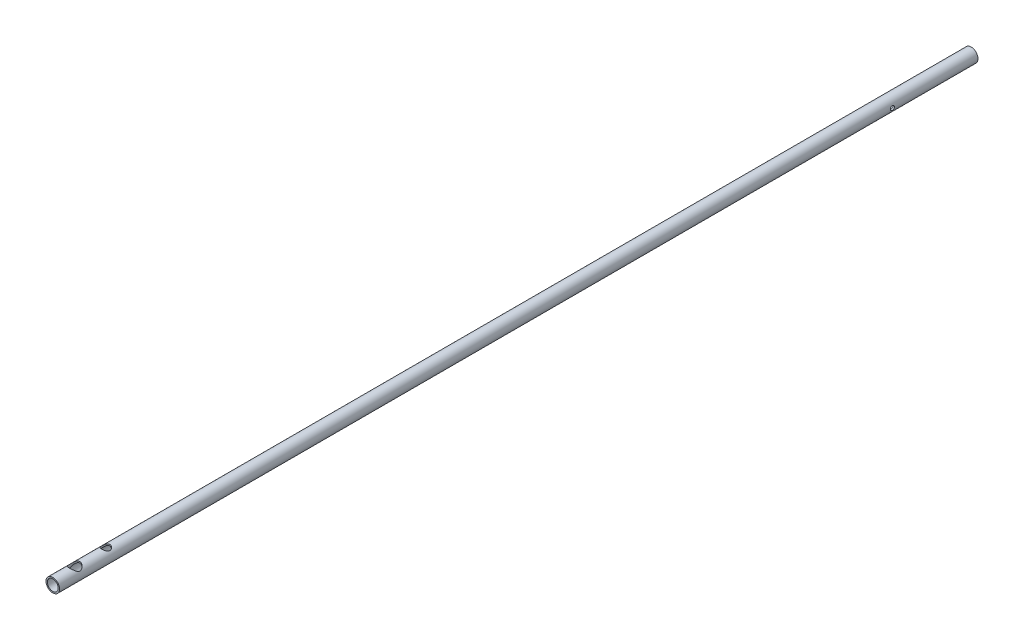
from build123d import *

# Parameters (mm, degrees)
SKETCH_1_R               = 5
SKETCH_1_R_2             = 4
EXTRUDE_1_DEPTH          = 676.5
CUT_EXTRUDE_1_DEPTH      = 677.536953906
CUT_EXTRUDE_1_DEPTH_BACK = 677.536953906
SKETCH_2_R               = 2
SKETCH_2_R_2             = 1.5
SKETCH_2_3_R             = 4
SKETCH_2_3_R_2           = 3
CUT_EXTRUDE_2_DEPTH      = 677.536954007
CUT_EXTRUDE_3_DEPTH      = 677.536954007
CUT_EXTRUDE_3_DEPTH_BACK = 677.536954007
SKETCH_3_R               = 1.5
SKETCH_3_3_R             = 3
CUT_EXTRUDE_4_DEPTH      = 10


with BuildPart() as part:
    # ｽｹｯﾁ1 → 押し出し-薄板1 (new body)
    with BuildSketch(Plane.XY):
        Circle(SKETCH_1_R)
        Circle(SKETCH_1_R_2, mode=Mode.SUBTRACT)
    extrude(amount=EXTRUDE_1_DEPTH)

    # ｽｹｯﾁ2 → ｶｯﾄ - 押し出し1 (cut, two sides: drawn at the far end of the back side and taken through both)
    with BuildSketch(Plane(origin=(0, 0, 0), x_dir=(1, 0, 0), z_dir=(0, 1, 0)).offset(-CUT_EXTRUDE_1_DEPTH_BACK)):
        with Locations((0, -660.5)):
            Circle(SKETCH_2_R)
        with Locations((0, -637.5)):
            Circle(SKETCH_2_R_2)
    extrude(amount=CUT_EXTRUDE_1_DEPTH + CUT_EXTRUDE_1_DEPTH_BACK, mode=Mode.SUBTRACT)

    # ｽｹｯﾁ2<3> → ｶｯﾄ - 押し出し2 (cut, through all)
    with BuildSketch(Plane(origin=(0, 0, 0), x_dir=(1, 0, 0), z_dir=(0, 1, 0))):
        with Locations((0, -660.5)):
            Circle(SKETCH_2_3_R)
        with Locations((0, -637.5)):
            Circle(SKETCH_2_3_R_2)
    extrude(amount=CUT_EXTRUDE_2_DEPTH, mode=Mode.SUBTRACT)

    # ｽｹｯﾁ3 → ｶｯﾄ - 押し出し3 (cut, two sides: drawn at the far end of the back side and taken through both)
    with BuildSketch(Plane(origin=(0, 0, 0), x_dir=(0, 0, -1), z_dir=(1, 0, 0)).offset(-CUT_EXTRUDE_3_DEPTH_BACK)):
        with Locations((-63, 0)):
            Circle(SKETCH_3_R)
    extrude(amount=CUT_EXTRUDE_3_DEPTH + CUT_EXTRUDE_3_DEPTH_BACK, mode=Mode.SUBTRACT)

    # ｽｹｯﾁ3<3> → ｶｯﾄ - 押し出し4 (cut)
    with BuildSketch(Plane(origin=(0, 0, 0), x_dir=(0, 0, -1), z_dir=(1, 0, 0))):
        with Locations((-63, 0)):
            Circle(SKETCH_3_3_R)
    extrude(amount=-CUT_EXTRUDE_4_DEPTH, mode=Mode.SUBTRACT)


solid = part.part
